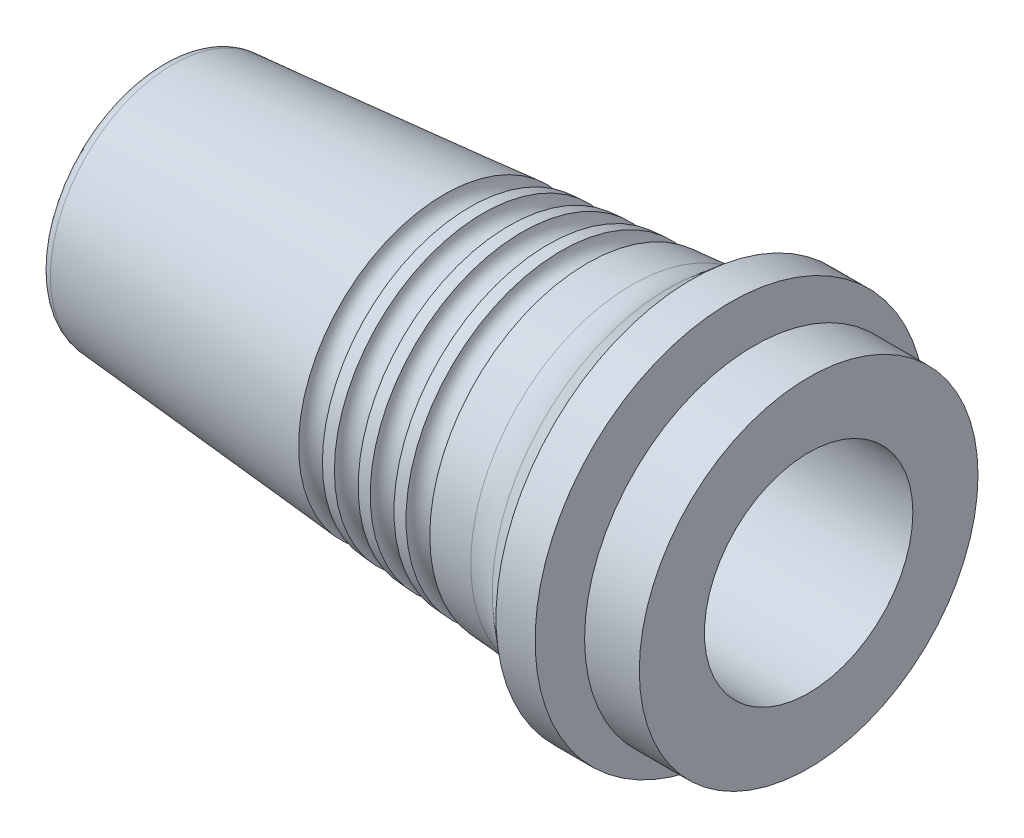
from build123d import *

# Parameters (mm, degrees)
FILLET1_R = 1
FILLET2_R = 5


with BuildPart() as part:
    # Sketch1 → Revolve1 (revolve)
    with BuildSketch(Plane.XY, mode=Mode.PRIVATE) as revolve1_sk:
        with BuildLine():
            Line((-24.378329548, 9.365110197), (-2.996501426, 11.158386562))
            ThreePointArc((-2.996501426, 11.158386562), (-1.916424244, 10.245460892), (-1.003498574, 11.325538075))
            Line((-1.003498574, 11.325538075), (0.003498574, 11.409994098))
            ThreePointArc((0.003498574, 11.409994098), (1.083575756, 10.497068428), (1.996501426, 11.577145611))
            Line((1.996501426, 11.577145611), (3.003498574, 11.661601635))
            ThreePointArc((3.003498574, 11.661601635), (4.083575756, 10.748675964), (4.996501426, 11.828753147))
            Line((4.996501426, 11.828753147), (6.003498574, 11.913209171))
            ThreePointArc((6.003498574, 11.913209171), (7.083575756, 11.000283501), (7.996501426, 12.080360684))
            Line((7.996501426, 12.080360684), (13, 12.5))
            Line((13, 12.5), (16, 15))
            Line((16, 15), (19, 15))
            Line((19, 15), (19, 10))
            Line((19, 10), (20.8, 10))
            Line((20.8, 10), (20.8, 13))
            Line((20.8, 13), (25, 13))
            Line((25, 13), (25, 8))
            Line((25, 8), (-25, 8))
            Line((-25, 8), (-24.378329548, 9.365110197))
        make_face()
    revolve(revolve1_sk.sketch.rotate(Axis((44.867132867, 0, 0), (-1, 0, 0)), 90), axis=Axis((44.867132867, 0, 0), (-1, 0, 0)))

    # Fillet1
    fillet1_edges = [part.edges().sort_by_distance(p)[0] for p in [
        (-24.378329548, 0, 9.365110197),
    ]]
    fillet(fillet1_edges, radius=FILLET1_R)

    # Fillet2
    fillet2_edges = [part.edges().sort_by_distance(p)[0] for p in [
        (13, 0, 12.5),
    ]]
    fillet(fillet2_edges, radius=FILLET2_R)


solid = part.part
